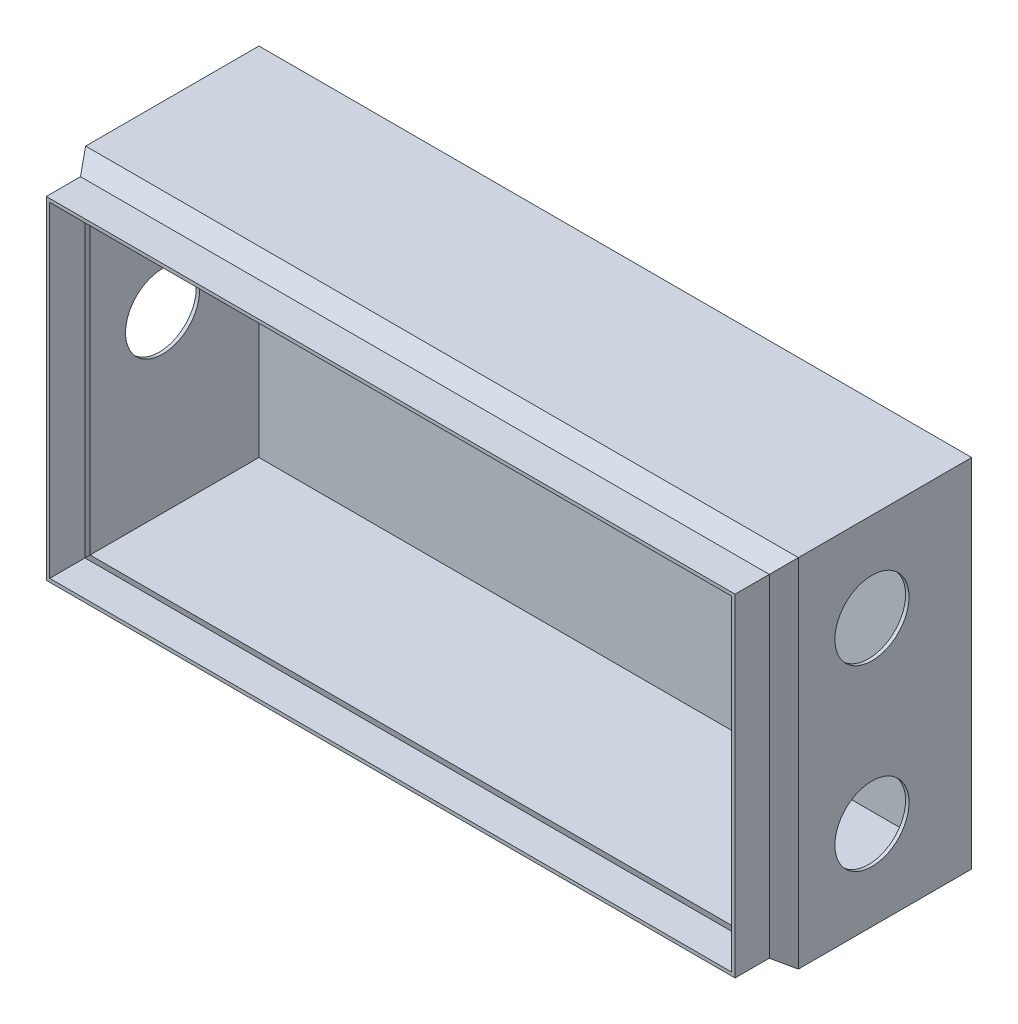
from build123d import *

# Parameters (mm, degrees)
SKETCH_1_W          = 250
SKETCH_1_H          = 125
EXTRUDE_1_DEPTH     = 60.8
SKETCH_4_W          = 250
SKETCH_4_H          = 125
EXTRUDE_2_DEPTH     = 6
EXTRUDE_2_TAPER     = 35
SKETCH_5_W          = 241.597509542
SKETCH_5_H          = 116.597509542
EXTRUDE_3_DEPTH     = 12
SHELL_1_T           = -1.2
SKETCH_9_R          = 13
CUT_EXTRUDE_2_DEPTH = 12
SKETCH_10_R         = 13
CUT_EXTRUDE_3_DEPTH = 12


with BuildPart() as part:
    # 草图1 → 凸台-拉伸1 (new body)
    with BuildSketch(Plane.XY):
        Rectangle(SKETCH_1_W, SKETCH_1_H)
    extrude(amount=EXTRUDE_1_DEPTH)

    # 草图4 → 凸台-拉伸2 (add)
    with BuildSketch(Plane.XY.offset(60.8)):
        Rectangle(SKETCH_4_W, SKETCH_4_H)
    extrude(amount=EXTRUDE_2_DEPTH, taper=EXTRUDE_2_TAPER)

    # 草图5 → 凸台-拉伸3 (add)
    with BuildSketch(Plane.XY.offset(66.8)):
        Rectangle(SKETCH_5_W, SKETCH_5_H)
    extrude(amount=EXTRUDE_3_DEPTH)

    # 抽壳1
    shell_1_openings = [part.faces().sort_by_distance(p)[0] for p in [
        (0, 0, 78.8),
    ]]
    offset(amount=SHELL_1_T, openings=shell_1_openings, kind=Kind.INTERSECTION)

    # 草图9 → 切除-拉伸2 (cut)
    with BuildSketch(Plane.ZY.offset(125)):
        with Locations((35, 0)):
            Circle(SKETCH_9_R)
    extrude(amount=-CUT_EXTRUDE_2_DEPTH, mode=Mode.SUBTRACT)

    # 草图10 → 切除-拉伸3 (cut)
    with BuildSketch(Plane(origin=(125, 0, 0), x_dir=(0, 0, -1), z_dir=(1, 0, 0))):
        with Locations((-35, 31.25)):
            Circle(SKETCH_10_R)
        with Locations((-35, -31.25)):
            Circle(SKETCH_10_R)
    extrude(amount=-CUT_EXTRUDE_3_DEPTH, mode=Mode.SUBTRACT)


solid = part.part
